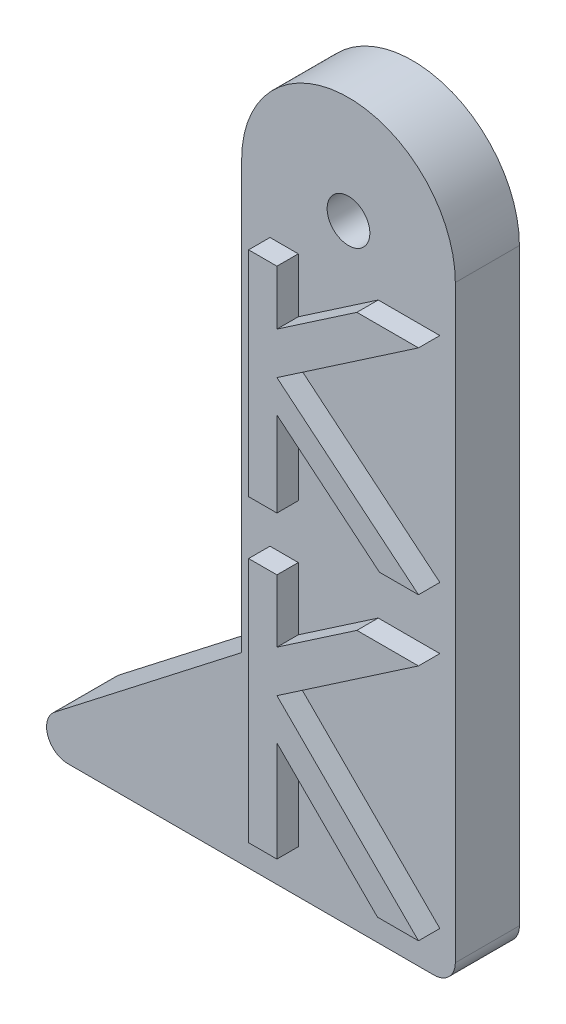
from build123d import *

# Parameters (mm, degrees)
SKETCH_1_R      = 1
EXTRUDE_1_DEPTH = 3
EXTRUDE_2_DEPTH = 3
FILLET_2_R      = 1
FILLET_3_R      = 1
EXTRUDE_3_DEPTH = 1


with BuildPart() as part:
    # 草图1 → 凸台-拉伸1 (new body)
    with BuildSketch(Plane.XY):
        with BuildLine():
            Line((-5, 0), (-5, -20))
            Line((-5, -20), (5, -20))
            Line((5, -20), (5, 0))
            ThreePointArc((5, 0), (0, 5), (-5, 0))
        make_face()
        Circle(SKETCH_1_R, mode=Mode.SUBTRACT)
    extrude(amount=EXTRUDE_1_DEPTH)

    # 草图2 → 凸台-拉伸2 (add)
    with BuildSketch(Plane.XY.offset(3)):
        Polygon((5, -20), (-5, -20), (-16.053330201, -28.571505672), (5, -28.571505672), align=None)
    extrude(amount=-EXTRUDE_2_DEPTH)

    # 圆角2
    fillet_2_edges = [part.edges().sort_by_distance(p)[0] for p in [
        (-16.053330201, -28.571505672, 1.5),
    ]]
    fillet(fillet_2_edges, radius=FILLET_2_R)

    # 圆角3
    fillet_3_edges = [part.edges().sort_by_distance(p)[0] for p in [
        (5, -28.571505672, 1.5),
    ]]
    fillet(fillet_3_edges, radius=FILLET_3_R)

    # 草图3 → 凸台-拉伸3 (add)
    with BuildSketch(Plane.XY.offset(3)):
        Polygon((-3.674988176, -2.510402489), (-3.674988176, -12.516814932), (-2.349938126, -12.516814932), (-2.349938126, -8.541664784), (2.447656881, -12.516814932), (4.275312121, -12.516814932), (-2.349938126, -7.02732187), (4.275312121, -2.510402489), (1.392652218, -2.510402489), (-2.349938126, -5.062001029), (-2.349938126, -2.510402489), align=None)
        Polygon((-3.674988176, -15.023538628), (-3.674988176, -26.544068904), (-2.349938126, -26.544068904), (-2.349938126, -21.837856659), (2.356274118, -26.544068904), (4.275312121, -26.544068904), (-2.349938126, -19.918818657), (4.275312121, -15.401899276), (1.392652218, -15.401899276), (-2.349938126, -17.953497816), (-2.349938126, -15.023538628), align=None)
    extrude(amount=EXTRUDE_3_DEPTH)


solid = part.part
